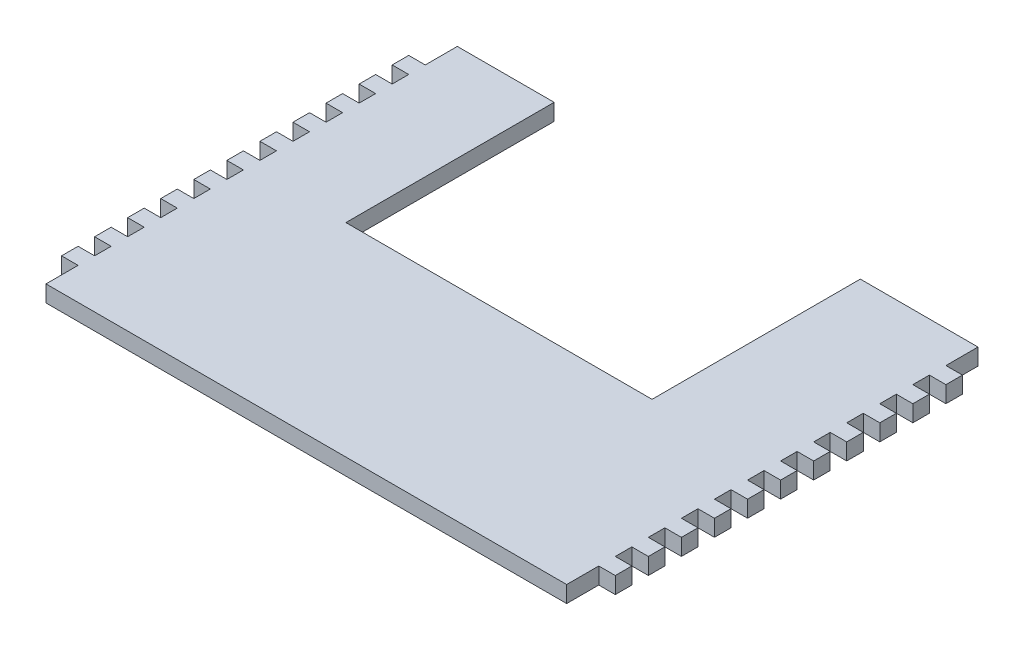
from build123d import *

# Parameters (mm, degrees)
SKETCH3_W                     = 100
SKETCH3_H                     = 79
BOSS_EXTRUDE1_DEPTH           = 3.175
SKETCH5_W                     = 58.8
SKETCH5_H                     = 40
CUT_EXTRUDE2_DEPTH            = 3.175
SKETCH11_W                    = 6.35
SKETCH11_H                    = 3.175
BOSS_EXTRUDE2_DEPTH           = 3.175
LPATTERN2_COUNT               = 6
LPATTERN2_PITCH               = 6.35
LPATTERN2_COPY_1_SKETCH_W     = 6.35
LPATTERN2_COPY_1_SKETCH_H     = 3.175
LPATTERN2_COPY_1_DEPTH        = 3.175
LPATTERN2_COPY_2_SKETCH_W     = 6.35
LPATTERN2_COPY_2_SKETCH_H     = 3.175
LPATTERN2_COPY_2_DEPTH        = 3.175
LPATTERN2_COPY_3_SKETCH_W     = 6.35
LPATTERN2_COPY_3_SKETCH_H     = 3.175
LPATTERN2_COPY_3_DEPTH        = 3.175
LPATTERN2_COPY_4_SKETCH_W     = 6.35
LPATTERN2_COPY_4_SKETCH_H     = 3.175
LPATTERN2_COPY_4_DEPTH        = 3.175
LPATTERN2_COPY_5_SKETCH_W     = 6.35
LPATTERN2_COPY_5_SKETCH_H     = 3.175
LPATTERN2_COPY_5_DEPTH        = 3.175
LPATTERN2_COL_COUNT           = 6
LPATTERN2_COL_PITCH           = 6.35
LPATTERN2_COL_COPY_1_SKETCH_W = 6.35
LPATTERN2_COL_COPY_1_SKETCH_H = 3.175
LPATTERN2_COL_COPY_1_DEPTH    = 3.175
LPATTERN2_COL_COPY_2_SKETCH_W = 6.35
LPATTERN2_COL_COPY_2_SKETCH_H = 3.175
LPATTERN2_COL_COPY_2_DEPTH    = 3.175
LPATTERN2_COL_COPY_3_SKETCH_W = 6.35
LPATTERN2_COL_COPY_3_SKETCH_H = 3.175
LPATTERN2_COL_COPY_3_DEPTH    = 3.175
LPATTERN2_COL_COPY_4_SKETCH_W = 6.35
LPATTERN2_COL_COPY_4_SKETCH_H = 3.175
LPATTERN2_COL_COPY_4_DEPTH    = 3.175
LPATTERN2_COL_COPY_5_SKETCH_W = 6.35
LPATTERN2_COL_COPY_5_SKETCH_H = 3.175
LPATTERN2_COL_COPY_5_DEPTH    = 3.175
SKETCH13_W                    = 12.35
SKETCH13_H                    = 79
BOSS_EXTRUDE4_DEPTH           = 3.175
SKETCH14_W                    = 12.35
SKETCH14_H                    = 79
BOSS_EXTRUDE5_DEPTH           = 3.175
SKETCH15_R                    = 1.5
CUT_EXTRUDE4_DEPTH            = 10
SKETCH16_R                    = 1.5
CUT_EXTRUDE5_DEPTH            = 10
SKETCH17_W                    = 12.35
SKETCH17_H                    = 79
CUT_EXTRUDE6_DEPTH            = 10


with BuildPart() as part:
    # Sketch3 → Boss-Extrude1 (new body)
    with BuildSketch(Plane(origin=(0, 0, 0), x_dir=(1, 0, 0), z_dir=(0, 1, 0))):
        with Locations((46, 22.5)):
            Rectangle(SKETCH3_W, SKETCH3_H)
    extrude(amount=BOSS_EXTRUDE1_DEPTH)

    # Sketch5 → Cut-Extrude2 (cut)
    with BuildSketch(Plane(origin=(0, 3.175, 0), x_dir=(1, 0, 0), z_dir=(0, 1, 0))):
        with Locations((44, 42)):
            Rectangle(SKETCH5_W, SKETCH5_H)
    extrude(amount=-CUT_EXTRUDE2_DEPTH, mode=Mode.SUBTRACT)

    # Sketch11 → Boss-Extrude2 (add)
    with BuildSketch(Plane(origin=(0, 3.175, 0), x_dir=(1, 0, 0), z_dir=(0, 1, 0))):
        with Locations((-4, 22.5)):
            Rectangle(SKETCH11_W, SKETCH11_H)
    boss_extrude2 = extrude(amount=-BOSS_EXTRUDE2_DEPTH)

    # Mirror2: Boss-Extrude2 across plane
    add(boss_extrude2.mirror(Plane.ZY.offset(-46)))

    # LPattern2: Boss-Extrude2 ×6
    with Locations(*[(0, 0, -i * LPATTERN2_PITCH) for i in range(1, LPATTERN2_COUNT)]):
        add(boss_extrude2)

    # LPattern2 copy 1 sketch → LPattern2 copy 1 (add)
    with BuildSketch(Plane(origin=(92, 3.175, -6.35), x_dir=(-1, 0, 0), z_dir=(0, 1, 0))):
        with Locations((-4, -22.5)):
            Rectangle(LPATTERN2_COPY_1_SKETCH_W, LPATTERN2_COPY_1_SKETCH_H)
    extrude(amount=-LPATTERN2_COPY_1_DEPTH)

    # LPattern2 copy 2 sketch → LPattern2 copy 2 (add)
    with BuildSketch(Plane(origin=(92, 3.175, -12.7), x_dir=(-1, 0, 0), z_dir=(0, 1, 0))):
        with Locations((-4, -22.5)):
            Rectangle(LPATTERN2_COPY_2_SKETCH_W, LPATTERN2_COPY_2_SKETCH_H)
    extrude(amount=-LPATTERN2_COPY_2_DEPTH)

    # LPattern2 copy 3 sketch → LPattern2 copy 3 (add)
    with BuildSketch(Plane(origin=(92, 3.175, -19.05), x_dir=(-1, 0, 0), z_dir=(0, 1, 0))):
        with Locations((-4, -22.5)):
            Rectangle(LPATTERN2_COPY_3_SKETCH_W, LPATTERN2_COPY_3_SKETCH_H)
    extrude(amount=-LPATTERN2_COPY_3_DEPTH)

    # LPattern2 copy 4 sketch → LPattern2 copy 4 (add)
    with BuildSketch(Plane(origin=(92, 3.175, -25.4), x_dir=(-1, 0, 0), z_dir=(0, 1, 0))):
        with Locations((-4, -22.5)):
            Rectangle(LPATTERN2_COPY_4_SKETCH_W, LPATTERN2_COPY_4_SKETCH_H)
    extrude(amount=-LPATTERN2_COPY_4_DEPTH)

    # LPattern2 copy 5 sketch → LPattern2 copy 5 (add)
    with BuildSketch(Plane(origin=(92, 3.175, -31.75), x_dir=(-1, 0, 0), z_dir=(0, 1, 0))):
        with Locations((-4, -22.5)):
            Rectangle(LPATTERN2_COPY_5_SKETCH_W, LPATTERN2_COPY_5_SKETCH_H)
    extrude(amount=-LPATTERN2_COPY_5_DEPTH)

    # LPattern2 col: Boss-Extrude2 ×6
    with Locations(*[(0, 0, i * LPATTERN2_COL_PITCH) for i in range(1, LPATTERN2_COL_COUNT)]):
        add(boss_extrude2)

    # LPattern2 col copy 1 sketch → LPattern2 col copy 1 (add)
    with BuildSketch(Plane(origin=(92, 3.175, 6.35), x_dir=(-1, 0, 0), z_dir=(0, 1, 0))):
        with Locations((-4, -22.5)):
            Rectangle(LPATTERN2_COL_COPY_1_SKETCH_W, LPATTERN2_COL_COPY_1_SKETCH_H)
    extrude(amount=-LPATTERN2_COL_COPY_1_DEPTH)

    # LPattern2 col copy 2 sketch → LPattern2 col copy 2 (add)
    with BuildSketch(Plane(origin=(92, 3.175, 12.7), x_dir=(-1, 0, 0), z_dir=(0, 1, 0))):
        with Locations((-4, -22.5)):
            Rectangle(LPATTERN2_COL_COPY_2_SKETCH_W, LPATTERN2_COL_COPY_2_SKETCH_H)
    extrude(amount=-LPATTERN2_COL_COPY_2_DEPTH)

    # LPattern2 col copy 3 sketch → LPattern2 col copy 3 (add)
    with BuildSketch(Plane(origin=(92, 3.175, 19.05), x_dir=(-1, 0, 0), z_dir=(0, 1, 0))):
        with Locations((-4, -22.5)):
            Rectangle(LPATTERN2_COL_COPY_3_SKETCH_W, LPATTERN2_COL_COPY_3_SKETCH_H)
    extrude(amount=-LPATTERN2_COL_COPY_3_DEPTH)

    # LPattern2 col copy 4 sketch → LPattern2 col copy 4 (add)
    with BuildSketch(Plane(origin=(92, 3.175, 25.4), x_dir=(-1, 0, 0), z_dir=(0, 1, 0))):
        with Locations((-4, -22.5)):
            Rectangle(LPATTERN2_COL_COPY_4_SKETCH_W, LPATTERN2_COL_COPY_4_SKETCH_H)
    extrude(amount=-LPATTERN2_COL_COPY_4_DEPTH)

    # LPattern2 col copy 5 sketch → LPattern2 col copy 5 (add)
    with BuildSketch(Plane(origin=(92, 3.175, 31.75), x_dir=(-1, 0, 0), z_dir=(0, 1, 0))):
        with Locations((-4, -22.5)):
            Rectangle(LPATTERN2_COL_COPY_5_SKETCH_W, LPATTERN2_COL_COPY_5_SKETCH_H)
    extrude(amount=-LPATTERN2_COL_COPY_5_DEPTH)

    # Sketch13 → Boss-Extrude4 (add)
    with BuildSketch(Plane(origin=(0, 3.175, 0), x_dir=(1, 0, 0), z_dir=(0, 1, 0))):
        with Locations((-13.35, 22.5)):
            Rectangle(SKETCH13_W, SKETCH13_H)
    extrude(amount=-BOSS_EXTRUDE4_DEPTH)

    # Sketch14 → Boss-Extrude5 (add)
    with BuildSketch(Plane(origin=(0, 3.175, 0), x_dir=(1, 0, 0), z_dir=(0, 1, 0))):
        with Locations((105.35, 22.5)):
            Rectangle(SKETCH14_W, SKETCH14_H)
    extrude(amount=-BOSS_EXTRUDE5_DEPTH)

    # Sketch15 → Cut-Extrude4 (cut)
    with BuildSketch(Plane(origin=(0, 3.175, 0), x_dir=(1, 0, 0), z_dir=(0, 1, 0))):
        with Locations(Location((-13.35, 54, 0), (0, 0, 270))):
            Circle(SKETCH15_R)
        with Locations(Location((-13.35, -9, 0), (0, 0, 270))):
            Circle(SKETCH15_R)
    extrude(amount=-CUT_EXTRUDE4_DEPTH, mode=Mode.SUBTRACT)

    # Sketch16 → Cut-Extrude5 (cut)
    with BuildSketch(Plane(origin=(0, 3.175, 0), x_dir=(1, 0, 0), z_dir=(0, 1, 0))):
        with Locations(Location((105.35, 54, 0), (0, 0, 270))):
            Circle(SKETCH16_R)
        with Locations(Location((105.35, -9, 0), (0, 0, 270))):
            Circle(SKETCH16_R)
    extrude(amount=-CUT_EXTRUDE5_DEPTH, mode=Mode.SUBTRACT)

    # Sketch17 → Cut-Extrude6 (cut)
    with BuildSketch(Plane(origin=(0, 3.175, 0), x_dir=(1, 0, 0), z_dir=(0, 1, 0))):
        with Locations((-13.35, 22.5)):
            Rectangle(SKETCH17_W, SKETCH17_H)
        with Locations((105.35, 22.5)):
            Rectangle(SKETCH17_W, SKETCH17_H)
    extrude(amount=-CUT_EXTRUDE6_DEPTH, mode=Mode.SUBTRACT)


solid = part.part
